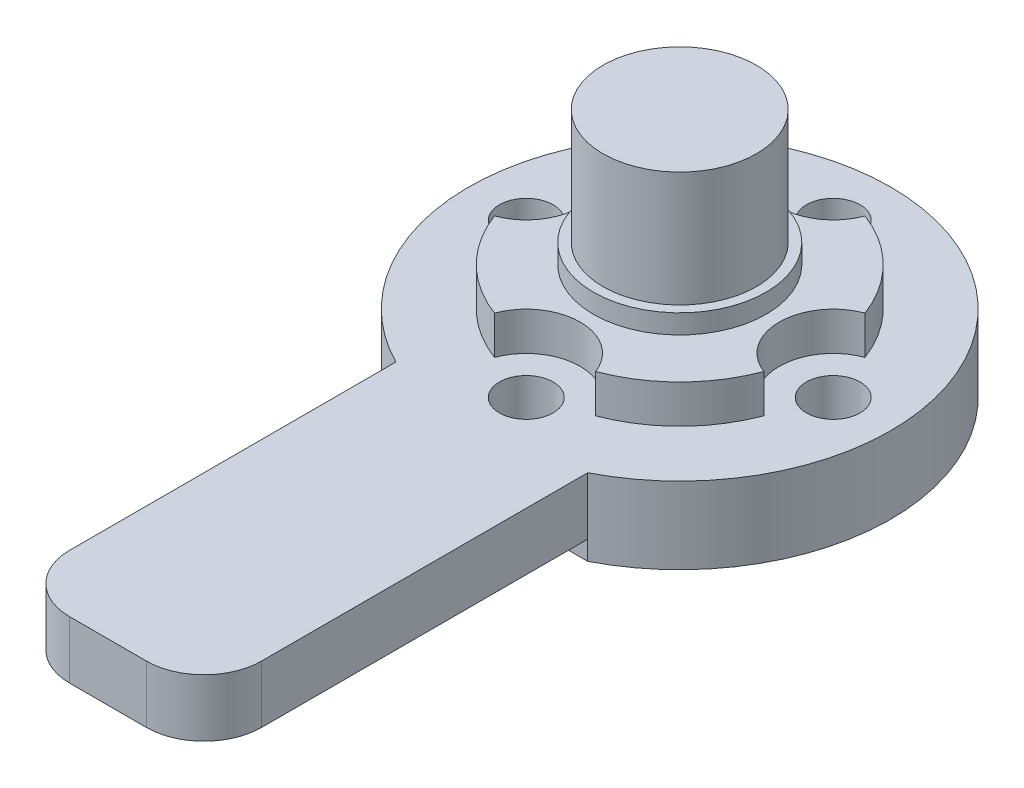
from build123d import *

# Parameters (mm, degrees)
SKETCH1_R           = 11
SKETCH1_R_2         = 4.25
BOSS_EXTRUDE1_DEPTH = 4
SKETCH2_R           = 1.4
CUT_EXTRUDE1_DEPTH  = 17.062378404
SKETCH3_R           = 7.5
BOSS_EXTRUDE2_DEPTH = 2
SKETCH4_R           = 2.811136831
CUT_EXTRUDE2_DEPTH  = 2
SKETCH5_R           = 4.5
BOSS_EXTRUDE3_DEPTH = 7
CUT_EXTRUDE3_START  = -6
SKETCH6_R           = 4.5
SKETCH6_R_2         = 4
CUT_EXTRUDE3_DEPTH  = 6
BOSS_EXTRUDE4_DEPTH = 4
SKETCH11_W          = 20
SKETCH11_H          = 1
CUT_EXTRUDE5_DEPTH  = 37.234215306
FILLET1_R           = 3


with BuildPart() as part:
    # Sketch1 → Boss-Extrude1 (new body)
    with BuildSketch(Plane(origin=(0, 0, 0), x_dir=(1, 0, 0), z_dir=(0, 1, 0))):
        with Locations(Location((0, 0, 0), (0, 0, 270))):
            Circle(SKETCH1_R)
        with Locations(Location((0, 0, 0), (0, 0, 270))):
            Circle(SKETCH1_R_2, mode=Mode.SUBTRACT)
    extrude(amount=BOSS_EXTRUDE1_DEPTH)

    # Sketch2 → Cut-Extrude1 (cut, through all)
    with BuildSketch(Plane(origin=(0, 4, 0), x_dir=(1, 0, 0), z_dir=(0, 1, 0))):
        with Locations(Location((0, 8, 0), (0, 0, 270))):
            Circle(SKETCH2_R)
        with Locations(Location((8, 0, 0), (0, 0, 270))):
            Circle(SKETCH2_R)
        with Locations(Location((0, -8, 0), (0, 0, 270))):
            Circle(SKETCH2_R)
        with Locations(Location((-8, 0, 0), (0, 0, 270))):
            Circle(SKETCH2_R)
    extrude(amount=-CUT_EXTRUDE1_DEPTH, mode=Mode.SUBTRACT)

    # Sketch3 → Boss-Extrude2 (add)
    with BuildSketch(Plane(origin=(0, 4, 0), x_dir=(1, 0, 0), z_dir=(0, 1, 0))):
        with Locations(Location((0, 0, 0), (0, 0, 80.315835906))):
            Circle(SKETCH3_R)
    extrude(amount=BOSS_EXTRUDE2_DEPTH)

    # Sketch4 → Cut-Extrude2 (cut)
    with BuildSketch(Plane(origin=(0, 6, 0), x_dir=(1, 0, 0), z_dir=(0, 1, 0))):
        with Locations((8, 0)):
            Circle(SKETCH4_R)
        with Locations((0, -8)):
            Circle(SKETCH4_R)
        with Locations((-8, 0)):
            Circle(SKETCH4_R)
        with Locations((0, 8)):
            Circle(SKETCH4_R)
    extrude(amount=-CUT_EXTRUDE2_DEPTH, mode=Mode.SUBTRACT)

    # Sketch5 → Boss-Extrude3 (add)
    with BuildSketch(Plane(origin=(0, 6, 0), x_dir=(1, 0, 0), z_dir=(0, 1, 0))):
        with Locations(Location((0, 0, 0), (0, 0, 270))):
            Circle(SKETCH5_R)
    extrude(amount=BOSS_EXTRUDE3_DEPTH)

    # Sketch6 → Cut-Extrude3 (cut)
    with BuildSketch(Plane(origin=(0, 13, 0), x_dir=(1, 0, 0), z_dir=(0, 1, 0)).offset(CUT_EXTRUDE3_START)):
        with Locations(Location((0, 0, 0), (0, 0, 270))):
            Circle(SKETCH6_R)
        with Locations(Location((0, 0, 0), (0, 0, 270))):
            Circle(SKETCH6_R_2, mode=Mode.SUBTRACT)
    extrude(amount=CUT_EXTRUDE3_DEPTH, mode=Mode.SUBTRACT)

    # Sketch8 → Boss-Extrude4 (add)
    with BuildSketch(Plane.XZ):
        with BuildLine():
            Line((5, 29.797958971), (-5, 29.797958971))
            Line((-5, 29.797958971), (-5, 9.797958971))
            ThreePointArc((-5, 9.797958971), (0, 11), (5, 9.797958971))
            Line((5, 9.797958971), (5, 29.797958971))
        make_face()
    extrude(amount=-BOSS_EXTRUDE4_DEPTH)

    # Sketch11 → Cut-Extrude5 (cut, through all)
    with BuildSketch(Plane.ZY.offset(5)):
        with Locations((19.797958971, 0.5)):
            Rectangle(SKETCH11_W, SKETCH11_H)
    extrude(amount=-CUT_EXTRUDE5_DEPTH, mode=Mode.SUBTRACT)

    # Fillet1
    fillet1_edges = [part.edges().sort_by_distance(p)[0] for p in [
        (5, 2.5, 29.797958971),
        (-5, 2.5, 29.797958971),
    ]]
    fillet(fillet1_edges, radius=FILLET1_R)


solid = part.part
